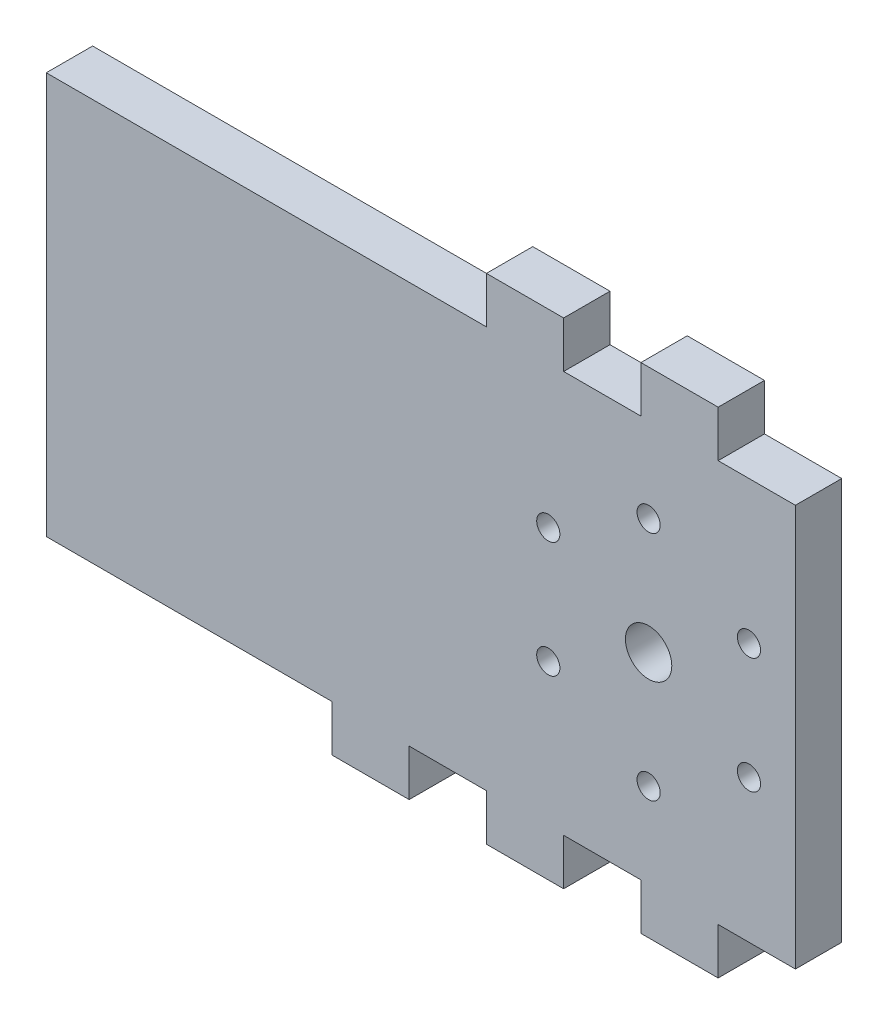
from build123d import *

# Parameters (mm, degrees)
SKETCH1_R           = 0.75
SKETCH1_R_2         = 1.5
BOSS_EXTRUDE1_DEPTH = 3


with BuildPart() as part:
    # Sketch1 → Boss-Extrude1 (new body)
    with BuildSketch(Plane.XY):
        Polygon((10, 0), (10, 3), (15, 3), (15, 0), (20, 0), (20, 3), (25, 3), (25, 0), (30, 0), (30, -26), (25, -26), (25, -29), (20, -29), (20, -26), (15, -26), (15, -29), (10, -29), (10, -26), (5, -26), (5, -29), (0, -29), (0, -26), (-18.49, -26), (-18.49, 0), (0, 0), align=None)
        with Locations((20.5, -5.5)):
            Circle(SKETCH1_R, mode=Mode.SUBTRACT)
        with Locations((26.995190528, -9.25)):
            Circle(SKETCH1_R, mode=Mode.SUBTRACT)
        with Locations((26.995190528, -16.75)):
            Circle(SKETCH1_R, mode=Mode.SUBTRACT)
        with Locations((20.5, -20.5)):
            Circle(SKETCH1_R, mode=Mode.SUBTRACT)
        with Locations((14.004809472, -16.75)):
            Circle(SKETCH1_R, mode=Mode.SUBTRACT)
        with Locations((14.004809472, -9.25)):
            Circle(SKETCH1_R, mode=Mode.SUBTRACT)
        with Locations((20.5, -13)):
            Circle(SKETCH1_R_2, mode=Mode.SUBTRACT)
    extrude(amount=BOSS_EXTRUDE1_DEPTH)


solid = part.part
